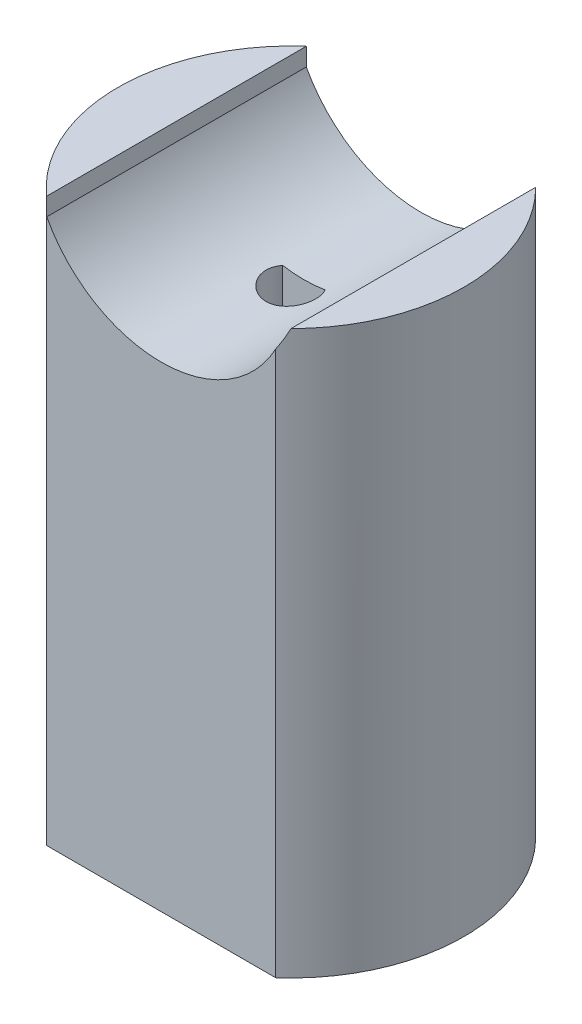
from build123d import *

# Parameters (mm, degrees)
SKETCH1_R           = 20
BOSS_EXTRUDE1_DEPTH = 30
SKETCH2_R           = 1.5
CUT_EXTRUDE1_DEPTH  = 18.5
CUT_EXTRUDE2_DEPTH  = 42.231056426
BOSS_EXTRUDE2_DEPTH = 40
SKETCH5_W           = 26.45751311
SKETCH5_H           = 5
CUT_EXTRUDE3_DEPTH  = 79.74007874


with BuildPart() as part:
    # Sketch1 → Boss-Extrude1 (new body)
    with BuildSketch(Plane(origin=(0, 0, 0), x_dir=(1, 0, 0), z_dir=(0, 1, 0))):
        with Locations(Location((0, 0, 0), (0, 0, 270))):
            Circle(SKETCH1_R)
        with BuildLine():
            Line((-2.452677109, 1.5), (2.452677109, 1.5))
            ThreePointArc((2.452677109, 1.5), (0, -2.875), (-2.452677109, 1.5))
        make_face(mode=Mode.SUBTRACT)
    extrude(amount=BOSS_EXTRUDE1_DEPTH)

    # Sketch2 → Cut-Extrude1 (cut)
    with BuildSketch(Plane(origin=(0, 0, -20), x_dir=(-1, 0, 0), z_dir=(0, 0, -1))):
        with Locations((0, 15)):
            Circle(SKETCH2_R)
    extrude(amount=-CUT_EXTRUDE1_DEPTH, mode=Mode.SUBTRACT)

    # Sketch3 → Cut-Extrude2 (cut, through all)
    with BuildSketch(Plane(origin=(0, 30, 0), x_dir=(1, 0, 0), z_dir=(0, 1, 0))):
        with BuildLine():
            ThreePointArc((-13.228756555, -15), (0, -20), (13.228756555, -15))
            Line((13.228756555, -15), (-13.228756555, -15))
        make_face()
        with BuildLine():
            Line((-13.228756555, 15), (13.228756555, 15))
            ThreePointArc((13.228756555, 15), (0, 20), (-13.228756555, 15))
        make_face()
    extrude(amount=-CUT_EXTRUDE2_DEPTH, mode=Mode.SUBTRACT)

    # Sketch4 → Boss-Extrude2 (add)
    with BuildSketch(Plane(origin=(0, 30, 0), x_dir=(1, 0, 0), z_dir=(0, 1, 0))):
        with BuildLine():
            Line((-13.228756555, -15), (13.228756555, -15))
            ThreePointArc((13.228756555, -15), (20, 0), (13.228756555, 15))
            Line((13.228756555, 15), (-13.228756555, 15))
            ThreePointArc((-13.228756555, 15), (-20, 0), (-13.228756555, -15))
        make_face()
        with BuildLine():
            Line((-2.452677109, 1.5), (2.452677109, 1.5))
            ThreePointArc((2.452677109, 1.5), (0, -2.875), (-2.452677109, 1.5))
        make_face(mode=Mode.SUBTRACT)
    extrude(amount=BOSS_EXTRUDE2_DEPTH)

    # Sketch5 → Cut-Extrude3 (cut, through all)
    with BuildSketch(Plane.XY.offset(15)):
        with Locations((0, 67.5)):
            Rectangle(SKETCH5_W, SKETCH5_H)
        with BuildLine():
            Line((13.228756555, 65), (-13.228756555, 65))
            Line((-13.228756555, 65), (-13.228756555, 62.928932188))
            ThreePointArc((-13.228756555, 62.928932188), (0, 55), (13.228756555, 62.928932188))
            Line((13.228756555, 62.928932188), (13.228756555, 65))
        make_face()
        with BuildLine():
            Line((14.142135624, 75), (-14.142135624, 75))
            ThreePointArc((-14.142135624, 75), (-15, 70), (-14.142135624, 65))
            Line((-14.142135624, 65), (-13.228756555, 65))
            Line((-13.228756555, 65), (-13.228756555, 70))
            Line((-13.228756555, 70), (13.228756555, 70))
            Line((13.228756555, 70), (13.228756555, 65))
            Line((13.228756555, 65), (14.142135624, 65))
            ThreePointArc((14.142135624, 65), (14.783978395, 67.463470319), (15, 70))
            ThreePointArc((15, 70), (14.783978395, 72.536529681), (14.142135624, 75))
        make_face()
        with BuildLine():
            Line((20, 75), (14.142135624, 75))
            ThreePointArc((14.142135624, 75), (14.783978395, 72.536529681), (15, 70))
            ThreePointArc((15, 70), (14.783978395, 67.463470319), (14.142135624, 65))
            Line((14.142135624, 65), (20, 65))
            Line((20, 65), (20, 75))
        make_face()
        with BuildLine():
            ThreePointArc((13.228756555, 62.928932188), (13.72456794, 63.947212637), (14.142135624, 65))
            Line((14.142135624, 65), (13.228756555, 65))
            Line((13.228756555, 65), (13.228756555, 62.928932188))
        make_face()
        with BuildLine():
            Line((-14.142135624, 75), (-20, 75))
            Line((-20, 75), (-20, 65))
            Line((-20, 65), (-14.142135624, 65))
            ThreePointArc((-14.142135624, 65), (-15, 70), (-14.142135624, 75))
        make_face()
    extrude(amount=-CUT_EXTRUDE3_DEPTH, mode=Mode.SUBTRACT)


solid = part.part
